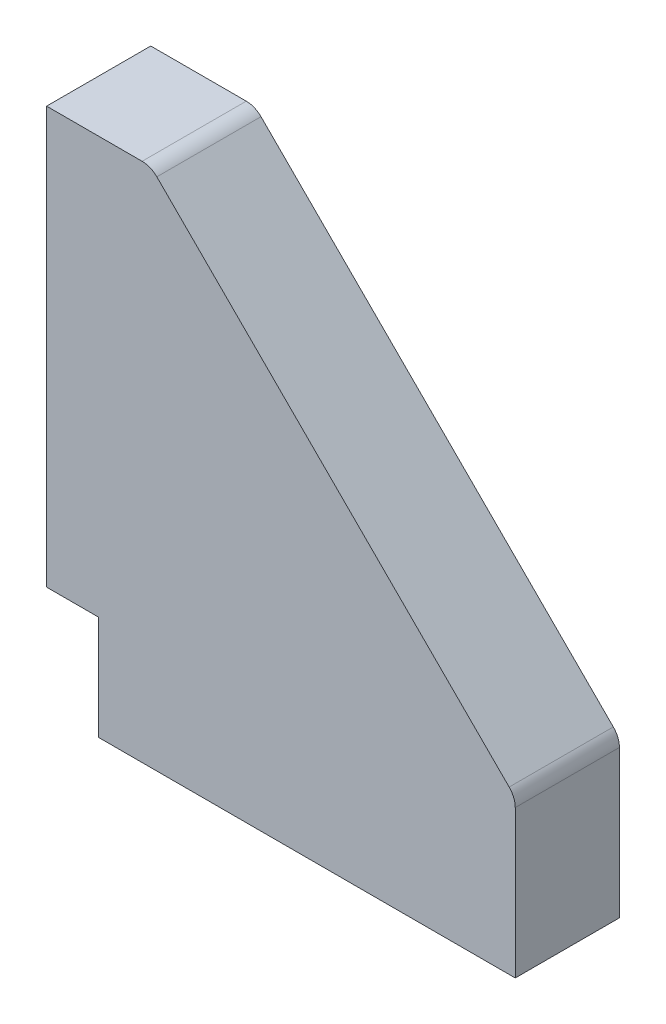
from build123d import *
from build123d.topology import SkipClean

# Parameters (mm, degrees)
BOSS_EXTRUDE1_DEPTH = 12.7
FILLET1_R           = 2.54
SKETCH2_R           = 3.175
CUT_EXTRUDE1_DEPTH  = 7.62
BOSS_EXTRUDE2_START = 12.7
SKETCH3_W           = 50.8
SKETCH3_H           = 12.7
SKETCH3_R           = 3.175
BOSS_EXTRUDE2_DEPTH = 12.7
BOSS_EXTRUDE3_START = 6.35
SKETCH4_W           = 12.7
SKETCH4_H           = 50.8
SKETCH4_R           = 3.175
BOSS_EXTRUDE3_DEPTH = 6.35


with BuildPart() as part:
    # Sketch1 → Boss-Extrude1 (new body)
    with BuildSketch(Plane.XY):
        Polygon((0, 0), (0, 50.8), (6.35, 50.8), (50.8, 6.35), (50.8, 0), align=None)
    extrude(amount=BOSS_EXTRUDE1_DEPTH)

    # Fillet1
    fillet1_edges = [part.edges().sort_by_distance(p)[0] for p in [
        (50.8, 6.35, 6.35),
        (6.35, 50.8, 6.35),
    ]]
    fillet(fillet1_edges, radius=FILLET1_R)

    # Sketch2 → Cut-Extrude1 (cut)
    with BuildSketch(Plane.ZY):
        with Locations((6.385256722, 44.45)):
            Circle(SKETCH2_R)
        with Locations((6.385256722, 6.35)):
            Circle(SKETCH2_R)
    cut_extrude1 = extrude(amount=-CUT_EXTRUDE1_DEPTH, mode=Mode.SUBTRACT)

    # Mirror1: Cut-Extrude1 across plane
    add(cut_extrude1.mirror(Plane(origin=(0, 0, 0), x_dir=(0, 0, 1), z_dir=(0.7071067811865475, -0.7071067811865477, 0))), mode=Mode.SUBTRACT)

    # Sketch3 → Boss-Extrude2 (add)
    with SkipClean():  # the faces are left unmerged after this step: merging them gives an invalid solid
        with BuildSketch(Plane.XZ.offset(BOSS_EXTRUDE2_START)):
            with Locations((25.4, 6.35)):
                Rectangle(SKETCH3_W, SKETCH3_H)
            with Locations((6.35, 6.385256722)):
                Circle(SKETCH3_R, mode=Mode.SUBTRACT)
            with Locations((44.45, 6.385256722)):
                Circle(SKETCH3_R, mode=Mode.SUBTRACT)
        extrude(amount=-BOSS_EXTRUDE2_DEPTH)

    # Sketch4 → Boss-Extrude3 (add)
    with BuildSketch(Plane.ZY.offset(BOSS_EXTRUDE3_START)):
        with Locations((6.35, 25.4)):
            Rectangle(SKETCH4_W, SKETCH4_H)
        with Locations((6.385256722, 44.45)):
            Circle(SKETCH4_R, mode=Mode.SUBTRACT)
        with Locations((6.385256722, 6.35)):
            Circle(SKETCH4_R, mode=Mode.SUBTRACT)
    extrude(amount=-BOSS_EXTRUDE3_DEPTH)


solid = part.part
